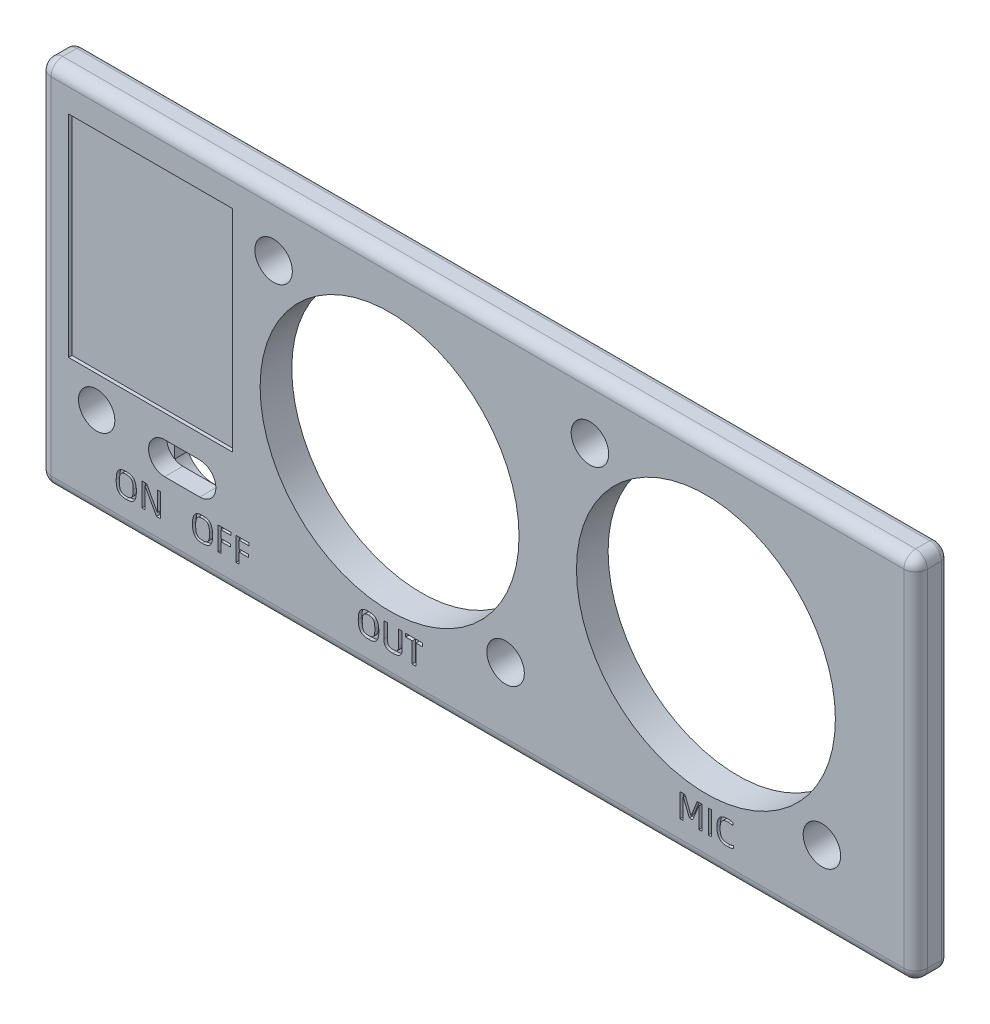
from build123d import *

# Parameters (mm, degrees)
SKETCH_1_W          = 74.8
SKETCH_1_H          = 31.5
EXTRUDE_1_DEPTH     = 2.7
FILLET_2_R          = 1
FILLET_3_R          = 1
FILLET_4_R          = 0.5
CUT_EXTRUDE_1_REACH = 42.671
SKETCH_3_R          = 11.05
SKETCH_3_R_2        = 1.6
SKETCH_3_R_3        = 1.55
SKETCH_5_W          = 0.259328747
SKETCH_5_H          = 2
CUT_EXTRUDE_3_DEPTH = 0.3
SKETCH_6_W          = 14
SKETCH_6_H          = 18
CUT_EXTRUDE_4_DEPTH = 0.3
CUT_EXTRUDE_7_DEPTH = 1.15
CUT_EXTRUDE_8_DEPTH = 1.55


with BuildPart() as part:
    # 草图1 → 凸台-拉伸1 (new body)
    with BuildSketch(Plane.XY):
        Rectangle(SKETCH_1_W, SKETCH_1_H)
    extrude(amount=EXTRUDE_1_DEPTH)

    # 圆角2
    fillet_2_edges = [part.edges().sort_by_distance(p)[0] for p in [
        (37.4, -15.75, 1.35),
        (-37.4, -15.75, 1.35),
        (-37.4, 15.75, 1.35),
        (37.4, 15.75, 1.35),
    ]]
    fillet(fillet_2_edges, radius=FILLET_2_R)

    # 圆角3
    fillet_3_edges = [part.edges().sort_by_distance(p)[0] for p in [
        (37.4, 0, 2.7),
        (0, -15.75, 2.7),
        (0, 15.75, 2.7),
        (-37.4, 0, 2.7),
        (37.107106781, 15.457106781, 2.7),
        (-37.107106781, 15.457106781, 2.7),
        (-37.107106781, -15.457106781, 2.7),
        (37.107106781, -15.457106781, 2.7),
    ]]
    fillet(fillet_3_edges, radius=FILLET_3_R)

    # 圆角4
    fillet_4_edges = [part.edges().sort_by_distance(p)[0] for p in [
        (37.4, 0, 0),
        (0, -15.75, 0),
        (-37.4, 0, 0),
        (0, 15.75, 0),
        (37.107106781, 15.457106781, 0),
        (-37.107106781, 15.457106781, 0),
        (-37.107106781, -15.457106781, 0),
        (37.107106781, -15.457106781, 0),
    ]]
    fillet(fillet_4_edges, radius=FILLET_4_R)

    # 草图3 → 切除-拉伸1 (cut, up to next)
    with BuildSketch(Plane.XY.offset(2.7), mode=Mode.PRIVATE) as cut_extrude_1_sk1:
        with Locations((19.5, 0.75)):
            Circle(SKETCH_3_R)
    cut_extrude_1_tool1 = extrude(cut_extrude_1_sk1.sketch, amount=-CUT_EXTRUDE_1_REACH, mode=Mode.PRIVATE) & part.part
    # 草图3 → 切除-拉伸1 (cut, up to next)
    with BuildSketch(Plane.XY.offset(2.7), mode=Mode.PRIVATE) as cut_extrude_1_sk2:
        with Locations((29.4, -9.15)):
            Circle(SKETCH_3_R_2)
    cut_extrude_1_tool2 = extrude(cut_extrude_1_sk2.sketch, amount=-CUT_EXTRUDE_1_REACH, mode=Mode.PRIVATE) & part.part
    # 草图3 → 切除-拉伸1 (cut, up to next)
    with BuildSketch(Plane.XY.offset(2.7), mode=Mode.PRIVATE) as cut_extrude_1_sk3:
        with Locations((9.6, 10.65)):
            Circle(SKETCH_3_R_2)
    cut_extrude_1_tool3 = extrude(cut_extrude_1_sk3.sketch, amount=-CUT_EXTRUDE_1_REACH, mode=Mode.PRIVATE) & part.part
    # 草图3 → 切除-拉伸1 (cut, up to next)
    with BuildSketch(Plane.XY.offset(2.7), mode=Mode.PRIVATE) as cut_extrude_1_sk4:
        with Locations((-7.5, 0.75)):
            Circle(SKETCH_3_R)
    cut_extrude_1_tool4 = extrude(cut_extrude_1_sk4.sketch, amount=-CUT_EXTRUDE_1_REACH, mode=Mode.PRIVATE) & part.part
    # 草图3 → 切除-拉伸1 (cut, up to next)
    with BuildSketch(Plane.XY.offset(2.7), mode=Mode.PRIVATE) as cut_extrude_1_sk5:
        with Locations((2.4, -9.15)):
            Circle(SKETCH_3_R_2)
    cut_extrude_1_tool5 = extrude(cut_extrude_1_sk5.sketch, amount=-CUT_EXTRUDE_1_REACH, mode=Mode.PRIVATE) & part.part
    # 草图3 → 切除-拉伸1 (cut, up to next)
    with BuildSketch(Plane.XY.offset(2.7), mode=Mode.PRIVATE) as cut_extrude_1_sk6:
        with Locations((-17.4, 10.65)):
            Circle(SKETCH_3_R_2)
    cut_extrude_1_tool6 = extrude(cut_extrude_1_sk6.sketch, amount=-CUT_EXTRUDE_1_REACH, mode=Mode.PRIVATE) & part.part
    # 草图3 → 切除-拉伸1 (cut, up to next)
    with BuildSketch(Plane.XY.offset(2.7), mode=Mode.PRIVATE) as cut_extrude_1_sk7:
        with Locations((-32.5, -7.94)):
            Circle(SKETCH_3_R_3)
    cut_extrude_1_tool7 = extrude(cut_extrude_1_sk7.sketch, amount=-CUT_EXTRUDE_1_REACH, mode=Mode.PRIVATE) & part.part
    add(cut_extrude_1_tool1.solids().sort_by_distance((19.5, 0.75, 2.7))[0], mode=Mode.SUBTRACT)
    add(cut_extrude_1_tool2.solids().sort_by_distance((29.4, -9.15, 2.7))[0], mode=Mode.SUBTRACT)
    add(cut_extrude_1_tool3.solids().sort_by_distance((9.6, 10.65, 2.7))[0], mode=Mode.SUBTRACT)
    add(cut_extrude_1_tool4.solids().sort_by_distance((-7.5, 0.75, 2.7))[0], mode=Mode.SUBTRACT)
    add(cut_extrude_1_tool5.solids().sort_by_distance((2.4, -9.15, 2.7))[0], mode=Mode.SUBTRACT)
    add(cut_extrude_1_tool6.solids().sort_by_distance((-17.4, 10.65, 2.7))[0], mode=Mode.SUBTRACT)
    add(cut_extrude_1_tool7.solids().sort_by_distance((-32.5, -7.94, 2.7))[0], mode=Mode.SUBTRACT)

    # 草图5 → 切除-拉伸3 (cut)
    # profile 1 of 11: a face of its own
    with BuildSketch(Plane.XY.offset(2.7)):
        with BuildLine():
            add(Edge.make_bspline(
                [(-10.175422139, -12.250208464), (-10.175091012, -12.218237941), (-10.174445682, -12.15593096), (-10.169767247, -12.065124616), (-10.162545565, -11.979543219), (-10.151680265, -11.899418443), (-10.137957329, -11.824553854), (-10.121558279, -11.754832877), (-10.101546843, -11.690495942), (-10.078508444, -11.631309875), (-10.052707196, -11.576667245), (-10.02335504, -11.526682234), (-9.991711495, -11.480473109), (-9.956982291, -11.438583656), (-9.919171246, -11.400742237), (-9.878455552, -11.367026633), (-9.834729706, -11.337577264), (-9.787953538, -11.312481917), (-9.738086053, -11.290845019), (-9.684992214, -11.272100449), (-9.628447092, -11.256229581), (-9.568542993, -11.243495238), (-9.505228554, -11.233391634), (-9.438682143, -11.226657238), (-9.368743481, -11.221653744), (-9.321008945, -11.221374939), (-9.296539504, -11.22123202)],
                knots=[0, 0, 0, 0, 1.462026452, 2.849326471, 4.157252872, 5.388680407, 6.545518137, 7.636937738, 8.662153731, 9.624067972, 10.539461797, 11.422420478, 12.272181682, 13.09815058, 13.907096025, 14.715167136, 15.511936701, 16.313885973, 17.139267794, 17.99561107, 18.886970506, 19.823155275, 20.794908778, 21.817540744, 22.881238592, 24, 24, 24, 24], degree=3))
            add(Edge.make_bspline(
                [(-9.296539504, -11.22123202), (-9.271931488, -11.221379633), (-9.223781347, -11.221668466), (-9.153283323, -11.226631366), (-9.086187942, -11.233412072), (-9.022710079, -11.243393342), (-8.962837506, -11.25629276), (-8.906425833, -11.27211117), (-8.853416245, -11.290738887), (-8.803793902, -11.31260794), (-8.757161183, -11.337455578), (-8.713773878, -11.367036159), (-8.673464653, -11.400872487), (-8.635659392, -11.438564732), (-8.600982565, -11.480493622), (-8.569234693, -11.526559396), (-8.540460044, -11.576798858), (-8.51453667, -11.631290184), (-8.491542095, -11.690501711), (-8.471517805, -11.754831179), (-8.455122534, -11.824554351), (-8.441398492, -11.899418297), (-8.430533516, -11.979543262), (-8.423311739, -12.065124603), (-8.418633332, -12.155930963), (-8.417987998, -12.218237942), (-8.417656869, -12.250208464)],
                knots=[0, 0, 0, 0, 1.124822508, 2.20092361, 3.229607339, 4.20738297, 5.137112646, 6.028239437, 6.884359206, 7.703707149, 8.505447112, 9.296745458, 10.099718228, 10.908452537, 11.734205856, 12.583745271, 13.463289018, 14.378443924, 15.340107104, 16.365055514, 17.456190253, 18.612726046, 19.843832178, 21.151417208, 22.538355139, 24, 24, 24, 24], degree=3))
            add(Edge.make_bspline(
                [(-8.417656869, -12.250208464), (-8.417985894, -12.282456983), (-8.418625852, -12.34518084), (-8.423313713, -12.43654228), (-8.430530929, -12.522541107), (-8.441413159, -12.603078165), (-8.455056545, -12.678239528), (-8.47160417, -12.7481994), (-8.491449519, -12.812725056), (-8.514566482, -12.872030793), (-8.54033533, -12.926468592), (-8.569359528, -12.976428004), (-8.600984885, -13.02241612), (-8.635536068, -13.064339549), (-8.673492843, -13.101617778), (-8.713764403, -13.135096388), (-8.757297802, -13.164136384), (-8.803683583, -13.189159026), (-8.853453466, -13.210465451), (-8.90642773, -13.228765522), (-8.962911464, -13.24397752), (-9.022658288, -13.257194232), (-9.086236169, -13.266422225), (-9.153275571, -13.273416651), (-9.223783425, -13.278318658), (-9.271932191, -13.278616012), (-9.296539504, -13.27876798)],
                knots=[0, 0, 0, 0, 1.473179387, 2.865356116, 4.178226816, 5.414646478, 6.576507541, 7.666775202, 8.696972224, 9.657871212, 10.572298884, 11.44564547, 12.294509793, 13.119606921, 13.923221706, 14.721501814, 15.508620172, 16.309723027, 17.125880275, 17.97922025, 18.867939648, 19.796930509, 20.77295909, 21.800825369, 22.876071339, 24, 24, 24, 24], degree=3))
            add(Edge.make_bspline(
                [(-9.296539504, -13.27876798), (-9.321008239, -13.278620713), (-9.368741399, -13.278333426), (-9.43868987, -13.273390374), (-9.5051801, -13.266443021), (-9.56859531, -13.25709416), (-9.628372871, -13.244039366), (-9.684989948, -13.228775932), (-9.738050759, -13.210361061), (-9.788061185, -13.189283201), (-9.83459978, -13.164020124), (-9.878444643, -13.135085654), (-9.919294788, -13.101762214), (-9.956949013, -13.063888769), (-9.991857972, -13.0219917), (-10.023208, -12.975441852), (-10.052837173, -12.925345871), (-10.078482748, -12.870337055), (-10.101558126, -12.810754487), (-10.121483739, -12.746117529), (-10.138023181, -12.676154546), (-10.151627362, -12.601127271), (-10.162555671, -12.520875675), (-10.169764301, -12.435291738), (-10.174446484, -12.344486124), (-10.175091284, -12.282179039), (-10.175422139, -12.250208464)],
                knots=[0, 0, 0, 0, 1.118092798, 2.181154946, 3.203175753, 4.17337173, 5.108997003, 5.998123703, 6.851854765, 7.674220522, 8.475690522, 9.268454686, 10.072011099, 10.88047309, 11.705948362, 12.560435231, 13.442866227, 14.36345027, 15.330710007, 16.36137917, 17.452146502, 18.614540047, 19.845231641, 21.152376382, 22.538847303, 24, 24, 24, 24], degree=3))
        make_face()
        with BuildLine():
            add(Edge.make_bspline(
                [(-8.757452575, -12.250208464), (-8.757703365, -12.227278397), (-8.758191326, -12.182663463), (-8.759350625, -12.117706461), (-8.763604159, -12.056728485), (-8.76768708, -11.999519596), (-8.774350299, -11.946210908), (-8.780831962, -11.896398552), (-8.790395622, -11.850779967), (-8.800081578, -11.808435125), (-8.812317895, -11.769460195), (-8.826334906, -11.733145181), (-8.842808268, -11.699411494), (-8.861317257, -11.66805708), (-8.882902233, -11.639834016), (-8.905681305, -11.613520816), (-8.931596074, -11.590550905), (-8.959513139, -11.569583755), (-8.99031169, -11.550997586), (-9.024305643, -11.53520231), (-9.061578686, -11.521853069), (-9.102231731, -11.511253494), (-9.146018908, -11.502247149), (-9.193317454, -11.496859768), (-9.243798918, -11.492848133), (-9.27860249, -11.492443348), (-9.296539504, -11.49223473)],
                knots=[0, 0, 0, 0, 1.516884309, 2.951395467, 4.296057234, 5.559491327, 6.744191238, 7.849212251, 8.880419525, 9.825779768, 10.721288282, 11.579944523, 12.398082627, 13.202103513, 13.983471365, 14.745345748, 15.500368052, 16.268868515, 17.052396337, 17.874861064, 18.744275377, 19.667430245, 20.651764461, 21.698466027, 22.813838751, 24, 24, 24, 24], degree=3))
            add(Edge.make_bspline(
                [(-9.296539504, -11.49223473), (-9.314198385, -11.492447171), (-9.34858502, -11.49286085), (-9.398513202, -11.496850827), (-9.445525736, -11.502287632), (-9.489181134, -11.511248576), (-9.529828463, -11.52186045), (-9.567119558, -11.535179364), (-9.60115989, -11.551126738), (-9.632269818, -11.56943394), (-9.660257567, -11.59068779), (-9.686549381, -11.613502388), (-9.709761663, -11.639709596), (-9.731357295, -11.668056983), (-9.749770124, -11.699519906), (-9.766845334, -11.733026372), (-9.780735857, -11.769475897), (-9.792964957, -11.808437796), (-9.802850375, -11.850723599), (-9.811497504, -11.896500426), (-9.819114695, -11.946123281), (-9.824578293, -11.999588702), (-9.829843643, -12.056678645), (-9.83308108, -12.117730496), (-9.83453391, -12.182659092), (-9.834980156, -12.227276913), (-9.835209506, -12.250208464)],
                knots=[0, 0, 0, 0, 1.168411875, 2.275215018, 3.313354769, 4.298220612, 5.221874065, 6.091757937, 6.914666867, 7.706509375, 8.475424895, 9.237710757, 10.006131037, 10.787920896, 11.592376024, 12.415027915, 13.274147905, 14.170140072, 15.116010893, 16.146010812, 17.252966807, 18.437271281, 19.702157084, 21.047010521, 22.48229644, 24, 24, 24, 24], degree=3))
            add(Edge.make_bspline(
                [(-9.835209506, -12.250208464), (-9.834981126, -12.273279041), (-9.834536693, -12.318174879), (-9.833066804, -12.383658198), (-9.829862942, -12.445267693), (-9.82457058, -12.502911663), (-9.819144168, -12.556659351), (-9.811503966, -12.606419342), (-9.802795262, -12.652322541), (-9.793003326, -12.694761227), (-9.780874265, -12.733783009), (-9.766593564, -12.76984186), (-9.750551262, -12.803402476), (-9.731524605, -12.833915883), (-9.710699794, -12.862165835), (-9.687197714, -12.887560322), (-9.661804246, -12.91064131), (-9.633861942, -12.930928376), (-9.603142911, -12.948592693), (-9.568965162, -12.963553671), (-9.531601402, -12.976408239), (-9.49083812, -12.986694066), (-9.447008584, -12.995096292), (-9.399787603, -13.000812387), (-9.349257814, -13.004071132), (-9.314472254, -13.004582934), (-9.296539504, -13.004846779)],
                knots=[0, 0, 0, 0, 1.526677015, 2.970946117, 4.333967975, 5.607830071, 6.801103353, 7.907897389, 8.937746609, 9.892423701, 10.788284776, 11.638720326, 12.457180529, 13.24580341, 14.01460643, 14.776114719, 15.531434275, 16.281923869, 17.056425863, 17.871572868, 18.746950864, 19.668131094, 20.651090686, 21.698204336, 22.813371761, 24, 24, 24, 24], degree=3))
            add(Edge.make_bspline(
                [(-9.296539504, -13.004846779), (-9.278606706, -13.004583067), (-9.243821056, -13.004071523), (-9.193291907, -13.000810972), (-9.146068712, -12.99510112), (-9.102246699, -12.986677676), (-9.061585325, -12.97649601), (-9.024428277, -12.963454461), (-8.990335936, -12.94862283), (-8.959584728, -12.930799066), (-8.931337995, -12.910761097), (-8.905853459, -12.887701296), (-8.882859903, -12.861885316), (-8.861478742, -12.834080329), (-8.842562089, -12.803376128), (-8.826473236, -12.769849776), (-8.812218086, -12.73377895), (-8.800031865, -12.694769648), (-8.790455854, -12.652264133), (-8.780825447, -12.606521568), (-8.774321299, -12.55657173), (-8.767694195, -12.502980454), (-8.763585966, -12.44521814), (-8.759365818, -12.383681914), (-8.758188085, -12.318170579), (-8.757702237, -12.273277582), (-8.757452575, -12.250208464)],
                knots=[0, 0, 0, 0, 1.186661357, 2.301859905, 3.349002779, 4.331989805, 5.253195744, 6.119908255, 6.935078009, 7.709601619, 8.467568952, 9.222909587, 9.978250223, 10.752610023, 11.541254913, 12.359737959, 13.210197244, 14.106083321, 15.060787058, 16.092429108, 17.197916019, 18.392249835, 19.665383766, 21.028970966, 22.473280377, 24, 24, 24, 24], degree=3))
        make_face(mode=Mode.SUBTRACT)
    # profile 2 of 11: a face of its own
    with BuildSketch(Plane.XY.offset(2.7)):
        with BuildLine():
            Line((-7.991557223, -12.598759641), (-7.991557223, -11.25))
            Line((-7.991557223, -11.25), (-7.668855535, -11.25))
            Line((-7.668855535, -11.25), (-7.668855535, -12.544142172))
            add(Edge.make_bspline(
                [(-7.668855535, -12.544142172), (-7.668518817, -12.570575848), (-7.667880658, -12.620673857), (-7.659365765, -12.691394747), (-7.646484654, -12.753739796), (-7.627805946, -12.808099143), (-7.602770146, -12.855374366), (-7.569319195, -12.894485103), (-7.529952532, -12.927953238), (-7.482387971, -12.953978113), (-7.426611476, -12.973537081), (-7.361955117, -12.986702047), (-7.287999838, -12.995030116), (-7.235554609, -12.99599591), (-7.207734, -12.996508234)],
                knots=[0, 0, 0, 0, 1.255785645, 2.380008092, 3.380304161, 4.276618975, 5.104361565, 5.906207755, 6.708053945, 7.547965063, 8.467377313, 9.507812643, 10.67796999, 12, 12, 12, 12], degree=3))
            add(Edge.make_bspline(
                [(-7.207734, -12.996508234), (-7.179221272, -12.9959813), (-7.125257253, -12.994984008), (-7.049337243, -12.98680277), (-6.983186403, -12.973550467), (-6.926483604, -12.954116174), (-6.878683677, -12.927839291), (-6.838614509, -12.895474472), (-6.806684693, -12.856014123), (-6.781965411, -12.809757681), (-6.765031648, -12.755346559), (-6.752150996, -12.693095006), (-6.74494675, -12.621577839), (-6.744128164, -12.570979934), (-6.743693975, -12.544142172)],
                knots=[0, 0, 0, 0, 1.344665342, 2.544952683, 3.596659547, 4.521383321, 5.36059262, 6.157162784, 6.935284246, 7.738917507, 8.615815126, 9.613504482, 10.734172916, 12, 12, 12, 12], degree=3))
            Line((-6.743693975, -12.544142172), (-6.743693975, -11.25))
            Line((-6.743693975, -11.25), (-6.423910778, -11.25))
            Line((-6.423910778, -11.25), (-6.423910778, -12.598759641))
            add(Edge.make_bspline(
                [(-6.423910778, -12.598759641), (-6.424404472, -12.627274663), (-6.425360916, -12.682517419), (-6.434602391, -12.762488518), (-6.449946004, -12.836442774), (-6.470893707, -12.904793782), (-6.499248803, -12.96660845), (-6.532339493, -13.023368389), (-6.572991605, -13.073173814), (-6.61915243, -13.117582204), (-6.672171054, -13.15553812), (-6.730695336, -13.189132849), (-6.795687319, -13.216935597), (-6.866856287, -13.239330375), (-6.943946175, -13.257119537), (-7.027394898, -13.270023578), (-7.116987056, -13.277400872), (-7.178813274, -13.278303266), (-7.210652491, -13.27876798)],
                knots=[0, 0, 0, 0, 1.143588631, 2.215498534, 3.223644746, 4.170531845, 5.076279685, 5.946373158, 6.798800392, 7.646620667, 8.508638769, 9.407617883, 10.349056482, 11.338200651, 12.397113159, 13.519965395, 14.722833767, 16, 16, 16, 16], degree=3))
            add(Edge.make_bspline(
                [(-7.210652491, -13.27876798), (-7.24277359, -13.27833682), (-7.304885426, -13.277503097), (-7.39480074, -13.269732126), (-7.478319985, -13.258079478), (-7.555545651, -13.240908918), (-7.626464064, -13.219232378), (-7.690755853, -13.191888687), (-7.748829244, -13.160242439), (-7.800789206, -13.123348129), (-7.846571749, -13.080388248), (-7.885435517, -13.03051122), (-7.918750893, -12.974585684), (-7.945284725, -12.911781819), (-7.966011078, -12.842693317), (-7.980800432, -12.767154085), (-7.990160245, -12.685159742), (-7.991080411, -12.628249468), (-7.991557223, -12.598759641)],
                knots=[0, 0, 0, 0, 1.287568754, 2.489742331, 3.615798836, 4.666193196, 5.65840245, 6.584664512, 7.462499505, 8.305200613, 9.132939746, 9.970096221, 10.832048753, 11.735625619, 12.69629275, 13.719117374, 14.818089813, 16, 16, 16, 16], degree=3))
        make_face()
    # profile 3 of 11: a face of its own
    with BuildSketch(Plane.XY.offset(2.7)):
        Polygon((-4.683656452, -11.25), (-4.683656452, -11.535178236), (-5.24567438, -11.535178236), (-5.24567438, -13.25), (-5.568376068, -13.25), (-5.568376068, -11.535178236), (-6.129977069, -11.535178236), (-6.129977069, -11.25), align=None)
    # profile 4 of 11: a face of its own
    with BuildSketch(Plane.XY.offset(2.7)):
        Polygon((17.296956431, -11.25), (17.711799041, -11.25), (18.22211799, -12.538305191), (18.239212008, -12.538305191), (18.749530957, -11.25), (19.158536585, -11.25), (19.158536585, -13.25), (18.899207838, -13.25), (18.899207838, -11.512247238), (18.882113821, -11.512247238), (18.368876381, -12.797633938), (18.086616635, -12.797633938), (17.567959141, -11.512247238), (17.550448197, -11.512247238), (17.550448197, -13.25), (17.296956431, -13.25), align=None)
    # profile 5 of 11: a face of its own
    with BuildSketch(Plane.XY.offset(2.7)):
        with Locations((19.828121743, -12.25)):
            Rectangle(SKETCH_5_W, SKETCH_5_H)
    # profile 6 of 11: a face of its own
    with BuildSketch(Plane.XY.offset(2.7)):
        with BuildLine():
            add(Edge.make_bspline(
                [(21.351990828, -13.27876798), (21.31820049, -13.278387072), (21.252178127, -13.277642822), (21.155848721, -13.268959058), (21.064494221, -13.255710068), (20.977970026, -13.237640793), (20.8968672, -13.211366105), (20.82136946, -13.176744553), (20.752187341, -13.13243196), (20.699418161, -13.088767593), (20.66093871, -13.049012661), (20.6333315, -13.016644355), (20.608016099, -12.981008774), (20.584312337, -12.942873213), (20.561524442, -12.902497372), (20.541343619, -12.858988172), (20.522495053, -12.812964266), (20.505249748, -12.76405606), (20.490491121, -12.711759939), (20.476885355, -12.656365861), (20.466384798, -12.597256883), (20.457080652, -12.534719723), (20.450085101, -12.468503358), (20.445312706, -12.398824895), (20.441628681, -12.325711099), (20.441491829, -12.275785029), (20.441421722, -12.250208464)],
                knots=[0, 0, 0, 0, 1.523156627, 2.976069641, 4.356745133, 5.684149788, 6.956332244, 8.192701355, 9.418224913, 10.650569991, 11.270957855, 11.911217595, 12.566809627, 13.239663254, 13.93532706, 14.655724879, 15.40045715, 16.17731736, 16.992432495, 17.849623595, 18.748056837, 19.698046219, 20.700054495, 21.7492121, 22.846946598, 24, 24, 24, 24], degree=3))
            add(Edge.make_bspline(
                [(20.441421722, -12.250208464), (20.441487219, -12.226576582), (20.441615203, -12.180399024), (20.445383241, -12.112574358), (20.449926029, -12.047575045), (20.457707717, -11.985464496), (20.46676458, -11.926051219), (20.477720085, -11.869456175), (20.49182298, -11.815898819), (20.511824109, -11.749018556), (20.542010204, -11.671512651), (20.585550578, -11.586526711), (20.63539592, -11.510692806), (20.693318102, -11.445057524), (20.757530217, -11.388202103), (20.828633646, -11.340350943), (20.906394112, -11.301275537), (20.990970338, -11.271661875), (21.081043773, -11.248948473), (21.176404661, -11.232810506), (21.276882346, -11.223139594), (21.345576104, -11.221878111), (21.380758808, -11.22123202)],
                knots=[0, 0, 0, 0, 0.882868472, 1.725157126, 2.537655949, 3.317036266, 4.063237615, 4.783266979, 5.469704118, 6.131743465, 7.391189443, 8.57103737, 9.694451703, 10.772605852, 11.832203786, 12.89082143, 13.966082781, 15.074818434, 16.232294977, 17.433491919, 18.685518243, 20, 20, 20, 20], degree=3))
            add(Edge.make_bspline(
                [(21.380758808, -11.22123202), (21.403138148, -11.221336282), (21.446250048, -11.221537133), (21.508673645, -11.224631275), (21.566536549, -11.22905365), (21.63695865, -11.237309775), (21.719372925, -11.251630541), (21.782395191, -11.269875401), (21.813112362, -11.27876798)],
                knots=[0, 0, 0, 0, 0.919803172, 1.771922719, 2.568459784, 3.304679194, 4.686295557, 6, 6, 6, 6], degree=3))
            Line((21.813112362, -11.27876798), (21.813112362, -11.518084219))
            add(Edge.make_bspline(
                [(21.813112362, -11.518084219), (21.782968235, -11.508097662), (21.720508971, -11.487405304), (21.638444922, -11.46984454), (21.568160346, -11.458601704), (21.510943292, -11.452924898), (21.450007883, -11.449650786), (21.408141284, -11.449138124), (21.386595789, -11.448874296)],
                knots=[0, 0, 0, 0, 1.315333107, 2.725397876, 3.471614051, 4.264833486, 5.107044223, 6, 6, 6, 6], degree=3))
            add(Edge.make_bspline(
                [(21.386595789, -11.448874296), (21.359202703, -11.449344451), (21.305975649, -11.450258002), (21.228839221, -11.457575054), (21.157124338, -11.470719441), (21.090486568, -11.487842174), (21.028875812, -11.510852717), (20.973426949, -11.541932705), (20.922659019, -11.578662668), (20.877857762, -11.623007108), (20.83825245, -11.673975847), (20.804501567, -11.732187392), (20.775695551, -11.797356786), (20.751965337, -11.869965131), (20.733631476, -11.950909681), (20.721273211, -12.040598479), (20.713132, -12.139433874), (20.712393412, -12.208358712), (20.712007505, -12.244371482)],
                knots=[0, 0, 0, 0, 1.086567246, 2.111290961, 3.069382265, 3.976017387, 4.838094748, 5.669683066, 6.490066879, 7.316540953, 8.161256226, 9.043424503, 9.97878647, 10.982972437, 12.068910134, 13.266465574, 14.571746442, 16, 16, 16, 16], degree=3))
            add(Edge.make_bspline(
                [(20.712007505, -12.244371482), (20.712479657, -12.282461981), (20.71338006, -12.355101173), (20.720312015, -12.458820686), (20.732090988, -12.552040004), (20.748912425, -12.635229889), (20.771199175, -12.709171805), (20.797921637, -12.774971474), (20.830330783, -12.832767121), (20.867386062, -12.883196577), (20.910743646, -12.925266692), (20.958811709, -12.960952896), (21.012635322, -12.989244389), (21.071862178, -13.010990078), (21.136426086, -13.0265691), (21.206369106, -13.036863075), (21.281642408, -13.044490776), (21.333763621, -13.045016539), (21.3607463, -13.045288722)],
                knots=[0, 0, 0, 0, 1.517588773, 2.894066162, 4.139285679, 5.258933509, 6.271430196, 7.212350669, 8.082573223, 8.905419379, 9.696384074, 10.480496416, 11.283082816, 12.110054844, 12.988378865, 13.924251085, 14.925403639, 16, 16, 16, 16], degree=3))
            add(Edge.make_bspline(
                [(21.3607463, -13.045288722), (21.383542232, -13.045023891), (21.42790817, -13.044508472), (21.492592884, -13.041233857), (21.553413288, -13.035550943), (21.62991943, -13.024192393), (21.724502462, -13.003717361), (21.798285745, -12.979918834), (21.83604336, -12.967740254)],
                knots=[0, 0, 0, 0, 0.84772027, 1.649851555, 2.407864224, 3.118293761, 4.525325113, 6, 6, 6, 6], degree=3))
            Line((21.83604336, -12.967740254), (21.83604336, -13.19246404))
            add(Edge.make_bspline(
                [(21.83604336, -13.19246404), (21.821392628, -13.198653945), (21.790824704, -13.211568833), (21.741202852, -13.227450654), (21.686766422, -13.242580901), (21.627317109, -13.255313977), (21.563741751, -13.265715997), (21.496387116, -13.273121207), (21.425435513, -13.277781202), (21.376874938, -13.278433645), (21.351990828, -13.27876798)],
                knots=[0, 0, 0, 0, 0.770769327, 1.608166549, 2.523581741, 3.509511314, 4.554112677, 5.645705944, 6.793578694, 8, 8, 8, 8], degree=3))
        make_face()
    # profile 7 of 11: a face of its own
    with BuildSketch(Plane.XY.offset(2.7)):
        Polygon((-20.352803836, -11.480560767), (-20.352803836, -12.128882635), (-19.55730665, -12.128882635), (-19.55730665, -12.359443402), (-20.352803836, -12.359443402), (-20.352803836, -13.25), (-20.612132583, -13.25), (-20.612132583, -11.25), (-19.49977069, -11.25), (-19.49977069, -11.480560767), align=None)
    # profile 8 of 11: a face of its own
    with BuildSketch(Plane.XY.offset(2.7)):
        Polygon((-21.87375443, -11.480560767), (-21.87375443, -12.128882635), (-21.078257244, -12.128882635), (-21.078257244, -12.359443402), (-21.87375443, -12.359443402), (-21.87375443, -13.25), (-22.133083177, -13.25), (-22.133083177, -11.25), (-21.020721284, -11.25), (-21.020721284, -11.480560767), align=None)
    # profile 9 of 11: a face of its own
    with BuildSketch(Plane.XY.offset(2.7)):
        with BuildLine():
            add(Edge.make_bspline(
                [(-23.463914947, -13.27876798), (-23.498406613, -13.278304839), (-23.565158123, -13.277408524), (-23.661910417, -13.267766882), (-23.752205536, -13.253712246), (-23.836054631, -13.232957002), (-23.913982375, -13.205430428), (-23.984689008, -13.167707026), (-24.049947858, -13.122541977), (-24.098104926, -13.076949791), (-24.133682747, -13.036750086), (-24.1583309, -13.003361096), (-24.181575749, -12.967798614), (-24.203000205, -12.92947928), (-24.222482274, -12.888617954), (-24.24040792, -12.845186401), (-24.256647561, -12.799251955), (-24.27122971, -12.750693457), (-24.284336331, -12.699280804), (-24.294795472, -12.644484315), (-24.304678193, -12.586724331), (-24.311786985, -12.525592086), (-24.31835576, -12.461414886), (-24.322240395, -12.393809157), (-24.324843581, -12.323052718), (-24.325137006, -12.274809792), (-24.325286637, -12.250208464)],
                knots=[0, 0, 0, 0, 1.59010963, 3.077329387, 4.479768649, 5.801054914, 7.056092773, 8.280262893, 9.485802185, 10.705585458, 11.327804267, 11.959750695, 12.617496188, 13.286081477, 13.982680013, 14.703961944, 15.451971165, 16.228540568, 17.04152172, 17.897501216, 18.800490738, 19.743315725, 20.735000393, 21.775263782, 22.865502757, 24, 24, 24, 24], degree=3))
            add(Edge.make_bspline(
                [(-24.325286637, -12.250208464), (-24.325140751, -12.225468052), (-24.324856276, -12.177224832), (-24.322227868, -12.106469303), (-24.318358564, -12.03900171), (-24.311780513, -11.974825878), (-24.304715624, -11.91382525), (-24.294793594, -11.856349156), (-24.284340644, -11.801964928), (-24.26718491, -11.735271367), (-24.242192909, -11.658080888), (-24.20468357, -11.573442128), (-24.160194949, -11.498684039), (-24.108301724, -11.433928408), (-24.04961901, -11.378935027), (-23.985240942, -11.331992817), (-23.913708136, -11.295286227), (-23.83619383, -11.266813519), (-23.752132481, -11.246512901), (-23.661991793, -11.231506984), (-23.565121833, -11.222792075), (-23.498398638, -11.221763569), (-23.463914947, -11.22123202)],
                knots=[0, 0, 0, 0, 0.951061613, 1.854547714, 2.721713425, 3.548383814, 4.334324672, 5.081788079, 5.790094633, 6.462617971, 7.728072485, 8.904693457, 10.014292493, 11.06312424, 12.083594982, 13.097822882, 14.115815101, 15.163857301, 16.265284262, 17.435226987, 18.674481326, 20, 20, 20, 20], degree=3))
            add(Edge.make_bspline(
                [(-23.463914947, -11.22123202), (-23.429431706, -11.221772511), (-23.362432535, -11.222822656), (-23.265144895, -11.231482599), (-23.174441502, -11.246495266), (-23.089879167, -11.266919493), (-23.011813112, -11.295076655), (-22.940132641, -11.332052967), (-22.87573117, -11.378663748), (-22.81790461, -11.434137966), (-22.766261384, -11.498549578), (-22.722919603, -11.573713936), (-22.685060262, -11.657961317), (-22.660618331, -11.735323368), (-22.64364562, -11.802020248), (-22.632292708, -11.856241816), (-22.623495536, -11.913920874), (-22.615240024, -11.974749711), (-22.60983585, -12.039056708), (-22.60496339, -12.106443281), (-22.602616613, -12.177229431), (-22.602292528, -12.225469611), (-22.602126329, -12.250208464)],
                knots=[0, 0, 0, 0, 1.324615671, 2.573660426, 3.748072883, 4.853929915, 5.911280648, 6.928579365, 7.942116327, 8.954147488, 9.998927781, 11.10230745, 12.278126854, 13.541061407, 14.213126592, 14.922017025, 15.668112076, 16.45418867, 17.279795405, 18.146715688, 19.049586293, 20, 20, 20, 20], degree=3))
            add(Edge.make_bspline(
                [(-22.602126329, -12.250208464), (-22.602296111, -12.274808245), (-22.602629052, -12.323048138), (-22.604949353, -12.3938353), (-22.609838516, -12.46135988), (-22.615233585, -12.525668316), (-22.623535667, -12.586628291), (-22.632280429, -12.644594172), (-22.643683066, -12.699214967), (-22.656513285, -12.750716612), (-22.671323661, -12.79915531), (-22.686883528, -12.845278556), (-22.704982798, -12.888594536), (-22.724340492, -12.929523265), (-22.745991001, -12.967522304), (-22.768108262, -13.003631544), (-22.79296119, -13.036587897), (-22.827846089, -13.076965625), (-22.875455931, -13.122774366), (-22.940670885, -13.167656774), (-23.011542462, -13.205639082), (-23.090016561, -13.232851073), (-23.174369152, -13.253729484), (-23.265225824, -13.267790857), (-23.362396704, -13.277376397), (-23.429423871, -13.278295186), (-23.463914947, -13.27876798)],
                knots=[0, 0, 0, 0, 1.133757215, 2.223285031, 3.263284128, 4.253721515, 5.196736651, 6.098113704, 6.954804784, 7.767255632, 8.543318481, 9.288723903, 10.009535344, 10.705679492, 11.373828665, 12.024243632, 12.655777845, 13.273387171, 14.483050573, 15.687803497, 16.911175096, 18.177438724, 19.504077791, 20.911925155, 22.410927592, 24, 24, 24, 24], degree=3))
        make_face()
        with BuildLine():
            add(Edge.make_bspline(
                [(-23.463914947, -13.056962685), (-23.434563811, -13.056478573), (-23.378636417, -13.055556118), (-23.299030915, -13.046618673), (-23.227915948, -13.033076021), (-23.164953512, -13.012939171), (-23.109382879, -12.98650012), (-23.060557377, -12.953351823), (-23.01812392, -12.913586748), (-22.982412012, -12.866877712), (-22.952369436, -12.813714092), (-22.927311381, -12.754126462), (-22.90785819, -12.687645766), (-22.893688957, -12.614153505), (-22.883043037, -12.53366067), (-22.875773887, -12.445717594), (-22.87117109, -12.350458997), (-22.870538172, -12.284402138), (-22.870210548, -12.250208464)],
                knots=[0, 0, 0, 0, 1.199272053, 2.285163994, 3.269995621, 4.153840096, 4.979585461, 5.776838968, 6.556472908, 7.346162015, 8.17053847, 9.04624012, 9.982648282, 10.996445545, 12.102710592, 13.300016778, 14.60238064, 16, 16, 16, 16], degree=3))
            add(Edge.make_bspline(
                [(-22.870210548, -12.250208464), (-22.870534403, -12.216709309), (-22.871159591, -12.152040783), (-22.875823604, -12.058453228), (-22.883029024, -11.971756214), (-22.893744941, -11.891826774), (-22.907985525, -11.818368277), (-22.927228132, -11.751416784), (-22.952367423, -11.691298251), (-22.98249929, -11.637646755), (-23.018227109, -11.590205294), (-23.060352094, -11.549140017), (-23.109440476, -11.515234336), (-23.164927038, -11.487536525), (-23.227744819, -11.465536504), (-23.298922673, -11.450687166), (-23.378618564, -11.441464271), (-23.434563046, -11.440581815), (-23.463914947, -11.440118824)],
                knots=[0, 0, 0, 0, 1.370257804, 2.645217547, 3.832103259, 4.927939735, 5.942505373, 6.89052672, 7.772131512, 8.602073474, 9.40138814, 10.193391476, 10.997704175, 11.831608624, 12.72340066, 13.712464826, 14.799818998, 16, 16, 16, 16], degree=3))
            add(Edge.make_bspline(
                [(-23.463914947, -11.440118824), (-23.492850551, -11.440577435), (-23.547964966, -11.441450964), (-23.626684911, -11.450745026), (-23.697279234, -11.46561927), (-23.759906521, -11.487418607), (-23.815119472, -11.515366946), (-23.8641841, -11.549100947), (-23.906198279, -11.590359857), (-23.942542069, -11.637379011), (-23.971995591, -11.691453313), (-23.997343575, -11.751383262), (-24.016367626, -11.818430418), (-24.031326426, -11.891764579), (-24.041833079, -11.971766698), (-24.049102478, -12.058450106), (-24.053747703, -12.152041657), (-24.054375597, -12.216709607), (-24.054700855, -12.250208464)],
                knots=[0, 0, 0, 0, 1.186310685, 2.259597526, 3.24574682, 4.139932001, 4.970987601, 5.777458692, 6.571587388, 7.376505845, 8.20587855, 9.08984915, 10.040414535, 11.058836022, 12.1576132, 13.347683949, 14.626065076, 16, 16, 16, 16], degree=3))
            add(Edge.make_bspline(
                [(-24.054700855, -12.250208464), (-24.054371783, -12.284401829), (-24.053736069, -12.350458094), (-24.049152629, -12.44572081), (-24.041818304, -12.533650015), (-24.031384512, -12.614216172), (-24.016496948, -12.687583955), (-23.997259443, -12.754159889), (-23.971994551, -12.813558167), (-23.942626072, -12.86714683), (-23.906305463, -12.913432797), (-23.863977846, -12.953390432), (-23.815180943, -12.986369739), (-23.759875363, -13.013052474), (-23.697111089, -13.032998547), (-23.626576382, -13.046565218), (-23.547946677, -13.055568408), (-23.492849722, -13.056482591), (-23.463914947, -13.056962685)],
                knots=[0, 0, 0, 0, 1.40137179, 2.707232333, 3.907753134, 5.016988362, 6.034639923, 6.973562222, 7.851615019, 8.675393717, 9.470698542, 10.252425699, 11.051819731, 11.874652689, 12.760870174, 13.742761313, 14.814586165, 16, 16, 16, 16], degree=3))
        make_face(mode=Mode.SUBTRACT)
    # profile 10 of 11: a face of its own
    with BuildSketch(Plane.XY.offset(2.7)):
        Polygon((-28.643819054, -11.25), (-28.237731916, -11.25), (-27.326745883, -12.909787367), (-27.309651866, -12.909787367), (-27.309651866, -11.25), (-27.050323119, -11.25), (-27.050323119, -13.25), (-27.393037315, -13.25), (-28.372816344, -11.489316239), (-28.390327288, -11.489316239), (-28.390327288, -13.25), (-28.643819054, -13.25), align=None)
    # profile 11 of 11: a face of its own
    with BuildSketch(Plane.XY.offset(2.7)):
        with BuildLine():
            add(Edge.make_bspline(
                [(-29.974650823, -13.27876798), (-30.00914249, -13.278304839), (-30.075894, -13.277408524), (-30.172646293, -13.267766882), (-30.262941412, -13.253712246), (-30.346790507, -13.232957002), (-30.424718252, -13.205430428), (-30.495424885, -13.167707026), (-30.560683735, -13.122541977), (-30.608840802, -13.076949791), (-30.644418623, -13.036750086), (-30.669066777, -13.003361096), (-30.692311625, -12.967798614), (-30.713736082, -12.92947928), (-30.73321815, -12.888617954), (-30.751143797, -12.845186401), (-30.767383437, -12.799251955), (-30.781965587, -12.750693457), (-30.795072208, -12.699280804), (-30.805531348, -12.644484315), (-30.815414069, -12.586724331), (-30.822522862, -12.525592086), (-30.829091637, -12.461414886), (-30.832976271, -12.393809157), (-30.835579458, -12.323052718), (-30.835872883, -12.274809792), (-30.836022514, -12.250208464)],
                knots=[0, 0, 0, 0, 1.59010963, 3.077329387, 4.479768649, 5.801054914, 7.056092773, 8.280262893, 9.485802185, 10.705585458, 11.327804267, 11.959750695, 12.617496188, 13.286081477, 13.982680013, 14.703961944, 15.451971165, 16.228540568, 17.04152172, 17.897501216, 18.800490738, 19.743315725, 20.735000393, 21.775263782, 22.865502757, 24, 24, 24, 24], degree=3))
            add(Edge.make_bspline(
                [(-30.836022514, -12.250208464), (-30.835876628, -12.225468052), (-30.835592152, -12.177224832), (-30.832963745, -12.106469303), (-30.829094441, -12.03900171), (-30.82251639, -11.974825878), (-30.815451501, -11.91382525), (-30.80552947, -11.856349156), (-30.795076521, -11.801964928), (-30.777920787, -11.735271367), (-30.752928786, -11.658080888), (-30.715419447, -11.573442128), (-30.670930825, -11.498684039), (-30.619037601, -11.433928408), (-30.560354887, -11.378935027), (-30.495976818, -11.331992817), (-30.424444013, -11.295286227), (-30.346929707, -11.266813519), (-30.262868358, -11.246512901), (-30.17272767, -11.231506984), (-30.07585771, -11.222792075), (-30.009134515, -11.221763569), (-29.974650823, -11.22123202)],
                knots=[0, 0, 0, 0, 0.951061613, 1.854547714, 2.721713425, 3.548383814, 4.334324672, 5.081788079, 5.790094633, 6.462617971, 7.728072485, 8.904693457, 10.014292493, 11.06312424, 12.083594982, 13.097822882, 14.115815101, 15.163857301, 16.265284262, 17.435226987, 18.674481326, 20, 20, 20, 20], degree=3))
            add(Edge.make_bspline(
                [(-29.974650823, -11.22123202), (-29.940167583, -11.221772511), (-29.873168412, -11.222822656), (-29.775880772, -11.231482599), (-29.685177379, -11.246495266), (-29.600615044, -11.266919493), (-29.522548988, -11.295076655), (-29.450868517, -11.332052967), (-29.386467046, -11.378663748), (-29.328640487, -11.434137966), (-29.276997261, -11.498549578), (-29.23365548, -11.573713936), (-29.195796139, -11.657961317), (-29.171354207, -11.735323368), (-29.154381497, -11.802020248), (-29.143028584, -11.856241816), (-29.134231413, -11.913920874), (-29.1259759, -11.974749711), (-29.120571726, -12.039056708), (-29.115699266, -12.106443281), (-29.11335249, -12.177229431), (-29.113028405, -12.225469611), (-29.112862206, -12.250208464)],
                knots=[0, 0, 0, 0, 1.324615671, 2.573660426, 3.748072883, 4.853929915, 5.911280648, 6.928579365, 7.942116327, 8.954147488, 9.998927781, 11.10230745, 12.278126854, 13.541061407, 14.213126592, 14.922017025, 15.668112076, 16.45418867, 17.279795405, 18.146715688, 19.049586293, 20, 20, 20, 20], degree=3))
            add(Edge.make_bspline(
                [(-29.112862206, -12.250208464), (-29.113031988, -12.274808245), (-29.113364929, -12.323048138), (-29.115685229, -12.3938353), (-29.120574393, -12.46135988), (-29.125969461, -12.525668316), (-29.134271543, -12.586628291), (-29.143016306, -12.644594172), (-29.154418942, -12.699214967), (-29.167249162, -12.750716612), (-29.182059537, -12.79915531), (-29.197619405, -12.845278556), (-29.215718674, -12.888594536), (-29.235076369, -12.929523265), (-29.256726878, -12.967522304), (-29.278844139, -13.003631544), (-29.303697066, -13.036587897), (-29.338581965, -13.076965625), (-29.386191807, -13.122774366), (-29.451406762, -13.167656774), (-29.522278339, -13.205639082), (-29.600752437, -13.232851073), (-29.685105028, -13.253729484), (-29.775961701, -13.267790857), (-29.873132581, -13.277376397), (-29.940159748, -13.278295186), (-29.974650823, -13.27876798)],
                knots=[0, 0, 0, 0, 1.133757215, 2.223285031, 3.263284128, 4.253721515, 5.196736651, 6.098113704, 6.954804784, 7.767255632, 8.543318481, 9.288723903, 10.009535344, 10.705679492, 11.373828665, 12.024243632, 12.655777845, 13.273387171, 14.483050573, 15.687803497, 16.911175096, 18.177438724, 19.504077791, 20.911925155, 22.410927592, 24, 24, 24, 24], degree=3))
        make_face()
        with BuildLine():
            add(Edge.make_bspline(
                [(-29.974650823, -13.056962685), (-29.945299687, -13.056478573), (-29.889372294, -13.055556118), (-29.809766791, -13.046618673), (-29.738651825, -13.033076021), (-29.675689389, -13.012939171), (-29.620118756, -12.98650012), (-29.571293254, -12.953351823), (-29.528859797, -12.913586748), (-29.493147889, -12.866877712), (-29.463105312, -12.813714092), (-29.438047257, -12.754126462), (-29.418594066, -12.687645766), (-29.404424834, -12.614153505), (-29.393778914, -12.53366067), (-29.386509764, -12.445717594), (-29.381906967, -12.350458997), (-29.381274049, -12.284402138), (-29.380946425, -12.250208464)],
                knots=[0, 0, 0, 0, 1.199272053, 2.285163994, 3.269995621, 4.153840096, 4.979585461, 5.776838968, 6.556472908, 7.346162015, 8.17053847, 9.04624012, 9.982648282, 10.996445545, 12.102710592, 13.300016778, 14.60238064, 16, 16, 16, 16], degree=3))
            add(Edge.make_bspline(
                [(-29.380946425, -12.250208464), (-29.38127028, -12.216709309), (-29.381895467, -12.152040783), (-29.386559481, -12.058453228), (-29.393764901, -11.971756214), (-29.404480818, -11.891826774), (-29.418721401, -11.818368277), (-29.437964009, -11.751416784), (-29.4631033, -11.691298251), (-29.493235167, -11.637646755), (-29.528962985, -11.590205294), (-29.571087971, -11.549140017), (-29.620176352, -11.515234336), (-29.675662914, -11.487536525), (-29.738480696, -11.465536504), (-29.809658549, -11.450687166), (-29.889354441, -11.441464271), (-29.945298923, -11.440581815), (-29.974650823, -11.440118824)],
                knots=[0, 0, 0, 0, 1.370257804, 2.645217547, 3.832103259, 4.927939735, 5.942505373, 6.89052672, 7.772131512, 8.602073474, 9.40138814, 10.193391476, 10.997704175, 11.831608624, 12.72340066, 13.712464826, 14.799818998, 16, 16, 16, 16], degree=3))
            add(Edge.make_bspline(
                [(-29.974650823, -11.440118824), (-30.003586427, -11.440577435), (-30.058700842, -11.441450964), (-30.137420787, -11.450745026), (-30.20801511, -11.46561927), (-30.270642398, -11.487418607), (-30.325855349, -11.515366946), (-30.374919977, -11.549100947), (-30.416934156, -11.590359857), (-30.453277945, -11.637379011), (-30.482731468, -11.691453313), (-30.508079451, -11.751383262), (-30.527103503, -11.818430418), (-30.542062303, -11.891764579), (-30.552568956, -11.971766698), (-30.559838355, -12.058450106), (-30.56448358, -12.152041657), (-30.565111474, -12.216709607), (-30.565436731, -12.250208464)],
                knots=[0, 0, 0, 0, 1.186310685, 2.259597526, 3.24574682, 4.139932001, 4.970987601, 5.777458692, 6.571587388, 7.376505845, 8.20587855, 9.08984915, 10.040414535, 11.058836022, 12.1576132, 13.347683949, 14.626065076, 16, 16, 16, 16], degree=3))
            add(Edge.make_bspline(
                [(-30.565436731, -12.250208464), (-30.56510766, -12.284401829), (-30.564471945, -12.350458094), (-30.559888505, -12.44572081), (-30.55255418, -12.533650015), (-30.542120388, -12.614216172), (-30.527232825, -12.687583955), (-30.50799532, -12.754159889), (-30.482730428, -12.813558167), (-30.453361948, -12.86714683), (-30.41704134, -12.913432797), (-30.374713722, -12.953390432), (-30.32591682, -12.986369739), (-30.27061124, -13.013052474), (-30.207846966, -13.032998547), (-30.137312258, -13.046565218), (-30.058682553, -13.055568408), (-30.003585598, -13.056482591), (-29.974650823, -13.056962685)],
                knots=[0, 0, 0, 0, 1.40137179, 2.707232333, 3.907753134, 5.016988362, 6.034639923, 6.973562222, 7.851615019, 8.675393717, 9.470698542, 10.252425699, 11.051819731, 11.874652689, 12.760870174, 13.742761313, 14.814586165, 16, 16, 16, 16], degree=3))
        make_face(mode=Mode.SUBTRACT)
    extrude(amount=-CUT_EXTRUDE_3_DEPTH, mode=Mode.SUBTRACT)

    # 草图6 → 切除-拉伸4 (cut)
    with BuildSketch(Plane.XY.offset(2.7)):
        with Locations((-27.9, 3.75)):
            Rectangle(SKETCH_6_W, SKETCH_6_H)
    extrude(amount=-CUT_EXTRUDE_4_DEPTH, mode=Mode.SUBTRACT)

    # 草图4 → 切除-拉伸7 (cut)
    with BuildSketch(Plane(origin=(0, 0, 0), x_dir=(-1, 0, 0), z_dir=(0, 0, -1))):
        with BuildLine():
            Line((27.4, -7.412565791), (27.4, -9.787434209))
            ThreePointArc((27.4, -9.787434209), (22.7, -8.6), (27.4, -7.412565791))
        make_face()
    extrude(amount=-CUT_EXTRUDE_7_DEPTH, mode=Mode.SUBTRACT)

    # 草图7 → 切除-拉伸8 (cut)
    with BuildSketch(Plane.XY.offset(2.7)):
        with BuildLine():
            Line((-26.7, -7.23), (-23.7, -7.23))
            ThreePointArc((-23.7, -7.23), (-22.33, -8.6), (-23.7, -9.97))
            Line((-23.7, -9.97), (-26.7, -9.97))
            ThreePointArc((-26.7, -9.97), (-28.07, -8.6), (-26.7, -7.23))
        make_face()
    extrude(amount=-CUT_EXTRUDE_8_DEPTH, mode=Mode.SUBTRACT)


solid = part.part
